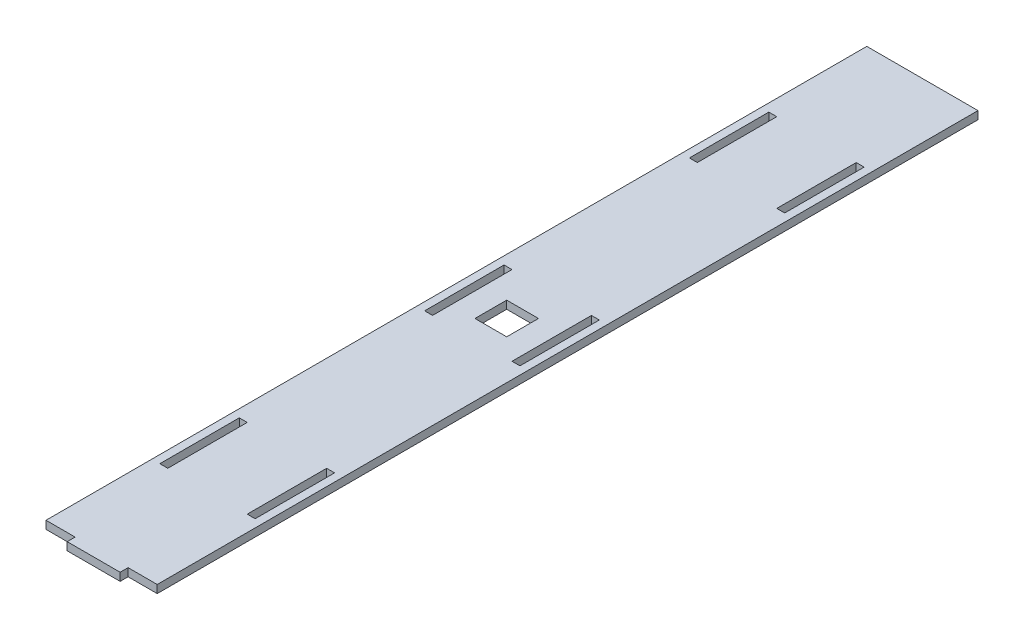
from build123d import *

# Parameters (mm, degrees)
SKETCH1_W           = 3
SKETCH1_H           = 30
SKETCH1_W_2         = 12
SKETCH1_H_2         = 12
BOSS_EXTRUDE1_DEPTH = 3


with BuildPart() as part:
    # Sketch1 → Boss-Extrude1 (new body)
    with BuildSketch(Plane(origin=(0, 0, 0), x_dir=(1, 0, 0), z_dir=(0, 1, 0))):
        Polygon((31, 0), (42, 0), (42, 310), (0, 310), (0, 0), (11, 0), (11, -3), (31, -3), align=None)
        with Locations((37.5, 55)):
            Rectangle(SKETCH1_W, SKETCH1_H, mode=Mode.SUBTRACT)
        with Locations((37.5, 155)):
            Rectangle(SKETCH1_W, SKETCH1_H, mode=Mode.SUBTRACT)
        with Locations((37.5, 255)):
            Rectangle(SKETCH1_W, SKETCH1_H, mode=Mode.SUBTRACT)
        with Locations((4.5, 255)):
            Rectangle(SKETCH1_W, SKETCH1_H, mode=Mode.SUBTRACT)
        with Locations((4.5, 155)):
            Rectangle(SKETCH1_W, SKETCH1_H, mode=Mode.SUBTRACT)
        with Locations((4.5, 55)):
            Rectangle(SKETCH1_W, SKETCH1_H, mode=Mode.SUBTRACT)
        with Locations((21, 153)):
            Rectangle(SKETCH1_W_2, SKETCH1_H_2, mode=Mode.SUBTRACT)
    extrude(amount=BOSS_EXTRUDE1_DEPTH)


solid = part.part
